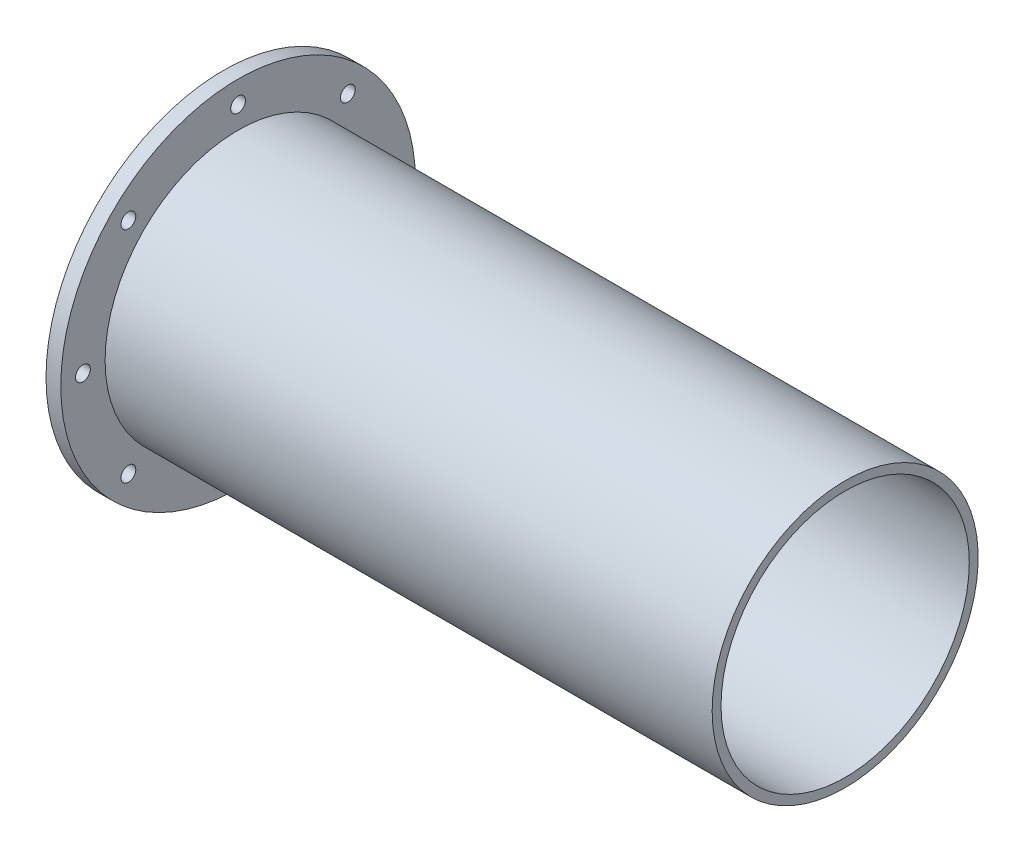
from build123d import *

# Parameters (mm, degrees)
SKETCH2_R          = 3.175
CUT_EXTRUDE1_DEPTH = 283.24063521
CIRPATTERN1_COUNT  = 8


with BuildPart() as part:
    # Sketch1 → Revolve1 (revolve)
    with BuildSketch(Plane.XY, mode=Mode.PRIVATE) as revolve1_sk:
        Polygon((0, 53.34), (267.208, 53.34), (267.208, 57.15), (6.35, 57.15), (6.35, 76.2), (0, 76.2), align=None)
    revolve(revolve1_sk.sketch.rotate(Axis((0, 0, 0), (1, 0, 0)), 90), axis=Axis((0, 0, 0), (1, 0, 0)))

    # Sketch2 → Cut-Extrude1 (cut, through all)
    with BuildSketch(Plane(origin=(6.35, 0, 0), x_dir=(0, 0, -1), z_dir=(1, 0, 0))):
        with Locations((-66.675, 0)):
            Circle(SKETCH2_R)
    cut_extrude1 = extrude(amount=-CUT_EXTRUDE1_DEPTH, mode=Mode.SUBTRACT)

    # CirPattern1: Cut-Extrude1 ×8 about axis
    cirpattern1_axis = Axis((0, 0, 0), (1, 0, 0))
    for i in range(1, CIRPATTERN1_COUNT):
        add(cut_extrude1.rotate(cirpattern1_axis, i * 360 / CIRPATTERN1_COUNT), mode=Mode.SUBTRACT)


solid = part.part
